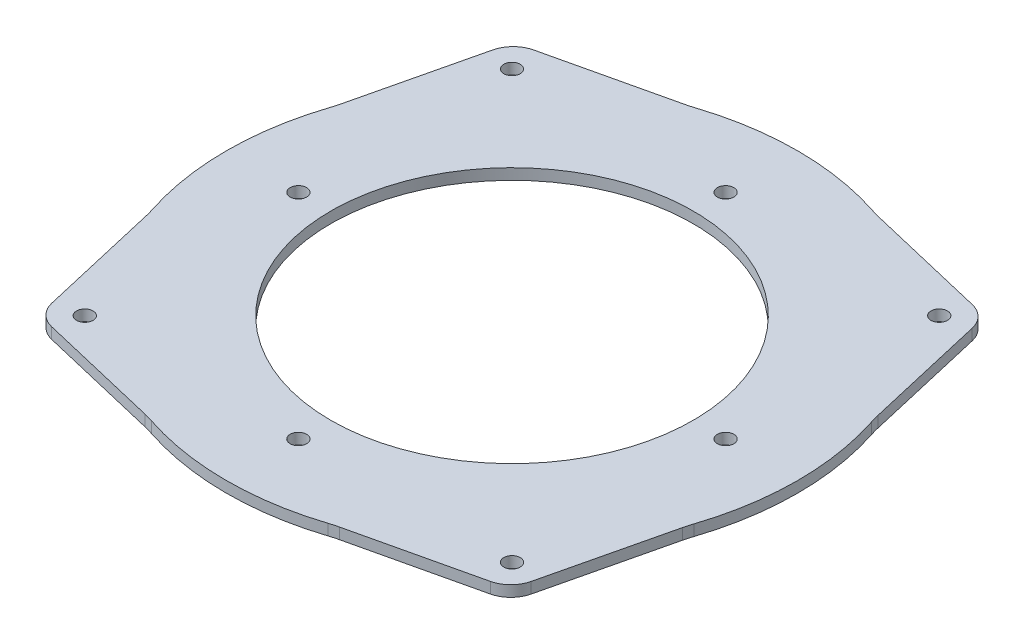
from build123d import *

# Parameters (mm, degrees)
SKETCH2_R           = 1.5
SKETCH2_R_2         = 33
BOSS_EXTRUDE1_DEPTH = 2


with BuildPart() as part:
    # Sketch2 → Boss-Extrude1 (new body)
    with BuildSketch(Plane(origin=(0, 0, 0), x_dir=(1, 0, 0), z_dir=(0, 1, 0))):
        with BuildLine():
            Line((17.897079586, 48.929734976), (40.149284407, 43.651218265))
            ThreePointArc((40.149284407, 43.651218265), (42.540265174, 42.312242187), (43.866371506, 39.91409958))
            Line((43.866371506, 39.91409958), (49.02521675, 17.633846579))
            ThreePointArc((49.02521675, 17.633846579), (49.23478351, 16.809026698), (49.479249782, 15.993868858))
            ThreePointArc((49.479249782, 15.993868858), (51.999812242, -0.139738387), (49.392575566, -16.259565766))
            ThreePointArc((49.392575566, -16.259565766), (49.143731732, -17.073397941), (48.929734976, -17.897079586))
            Line((48.929734976, -17.897079586), (43.651218265, -40.149284407))
            ThreePointArc((43.651218265, -40.149284407), (42.312242187, -42.540265174), (39.91409958, -43.866371506))
            Line((39.91409958, -43.866371506), (17.633846579, -49.02521675))
            ThreePointArc((17.633846579, -49.02521675), (16.809026698, -49.23478351), (15.993868858, -49.479249782))
            ThreePointArc((15.993868858, -49.479249782), (-0.139738387, -51.999812242), (-16.259565766, -49.392575566))
            ThreePointArc((-16.259565766, -49.392575566), (-17.073397941, -49.143731732), (-17.897079586, -48.929734976))
            Line((-17.897079586, -48.929734976), (-40.149284407, -43.651218265))
            ThreePointArc((-40.149284407, -43.651218265), (-42.540265174, -42.312242187), (-43.866371506, -39.91409958))
            Line((-43.866371506, -39.91409958), (-49.02521675, -17.633846579))
            ThreePointArc((-49.02521675, -17.633846579), (-49.23478351, -16.809026698), (-49.479249782, -15.993868858))
            ThreePointArc((-49.479249782, -15.993868858), (-51.999812242, 0.139738387), (-49.392575566, 16.259565766))
            ThreePointArc((-49.392575566, 16.259565766), (-49.143731732, 17.073397941), (-48.929734976, 17.897079586))
            Line((-48.929734976, 17.897079586), (-43.651218265, 40.149284407))
            ThreePointArc((-43.651218265, 40.149284407), (-42.312242187, 42.540265174), (-39.91409958, 43.866371506))
            Line((-39.91409958, 43.866371506), (-17.633846579, 49.02521675))
            ThreePointArc((-17.633846579, 49.02521675), (-16.809026698, 49.23478351), (-15.993868858, 49.479249782))
            ThreePointArc((-15.993868858, 49.479249782), (-8.026622704, 51.3767781), (0.139738387, 51.999812242))
            ThreePointArc((0.139738387, 51.999812242), (8.302633013, 51.332896714), (16.259565766, 49.392575566))
            ThreePointArc((16.259565766, 49.392575566), (17.073397941, 49.143731732), (17.897079586, 48.929734976))
        make_face()
        with Locations(Location((-38.8907, 38.8907, 0), (0, 0, 270))):
            Circle(SKETCH2_R, mode=Mode.SUBTRACT)
        with Locations(Location((38.8907, 38.8907, 0), (0, 0, 90))):
            Circle(SKETCH2_R, mode=Mode.SUBTRACT)
        with Locations(Location((38.8907, -38.8907, 0), (0, 0, 270))):
            Circle(SKETCH2_R, mode=Mode.SUBTRACT)
        with Locations(Location((-38.8907, -38.8907, 0), (0, 0, 90))):
            Circle(SKETCH2_R, mode=Mode.SUBTRACT)
        with Locations(Location((0, 0, 0), (0, 0, 270))):
            Circle(SKETCH2_R_2, mode=Mode.SUBTRACT)
        with Locations(Location((0, 38.8907, 0), (0, 0, 270))):
            Circle(SKETCH2_R, mode=Mode.SUBTRACT)
        with Locations(Location((38.8907, 0, 0), (0, 0, 270))):
            Circle(SKETCH2_R, mode=Mode.SUBTRACT)
        with Locations(Location((0, -38.8907, 0), (0, 0, 270))):
            Circle(SKETCH2_R, mode=Mode.SUBTRACT)
        with Locations(Location((-38.8907, 0, 0), (0, 0, 270))):
            Circle(SKETCH2_R, mode=Mode.SUBTRACT)
    extrude(amount=BOSS_EXTRUDE1_DEPTH)


solid = part.part
